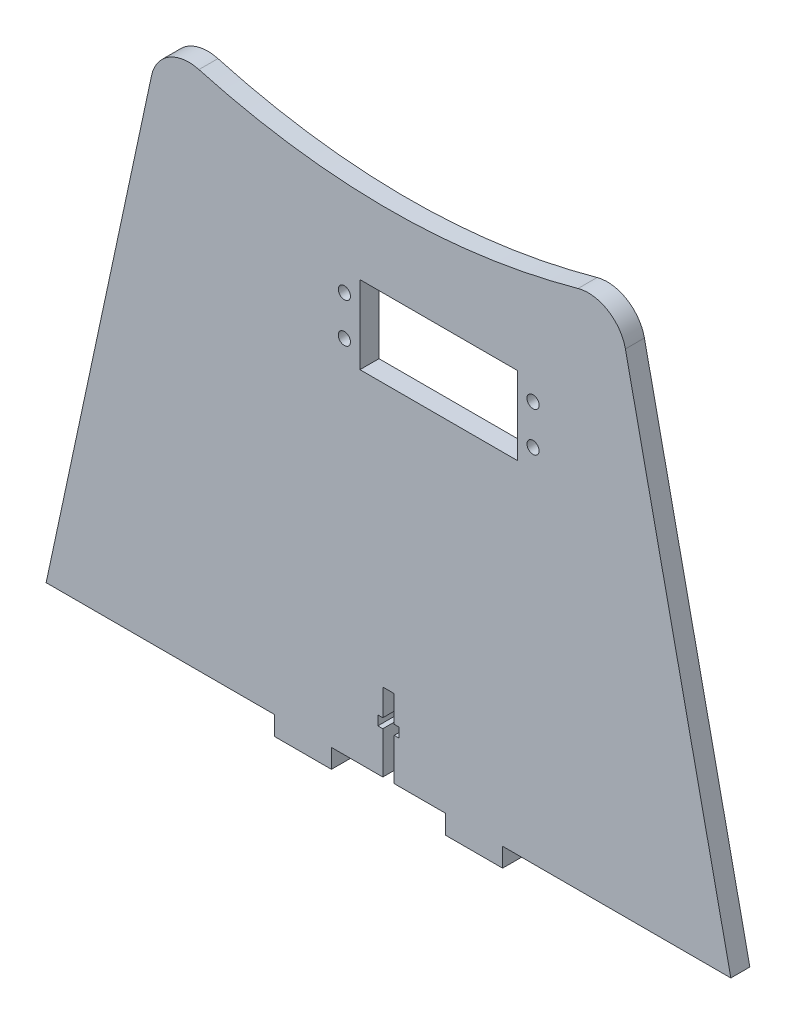
from build123d import *

# Parameters (mm, degrees)
SKETCH1_R           = 1.6
SKETCH1_W           = 41.4
SKETCH1_H           = 20.5
BOSS_EXTRUDE1_DEPTH = 5


with BuildPart() as part:
    # Sketch1 → Boss-Extrude1 (new body)
    with BuildSketch(Plane.XY):
        with BuildLine():
            Line((-27.829133209, -27.087428792), (-27.829133209, -32.087428792))
            Line((-27.829133209, -32.087428792), (-12.829133209, -32.087428792))
            Line((-12.829133209, -32.087428792), (-12.829133209, -27.087428792))
            Line((-12.829133209, -27.087428792), (0.670866791, -27.087428792))
            Line((0.670866791, -27.087428792), (0.670866791, -16.087428792))
            Line((0.670866791, -16.087428792), (-0.629133209, -16.087428792))
            Line((-0.629133209, -16.087428792), (-0.629133209, -13.587428792))
            Line((-0.629133209, -13.587428792), (0.670866791, -13.587428792))
            Line((0.670866791, -13.587428792), (0.670866791, -6.587428792))
            Line((0.670866791, -6.587428792), (3.670866791, -6.587428792))
            Line((3.670866791, -6.587428792), (3.670866791, -13.587428792))
            Line((3.670866791, -13.587428792), (4.970866791, -13.587428792))
            Line((4.970866791, -13.587428792), (4.970866791, -16.087428792))
            Line((4.970866791, -16.087428792), (3.670866791, -16.087428792))
            Line((3.670866791, -16.087428792), (3.670866791, -27.087428792))
            Line((3.670866791, -27.087428792), (17.170866791, -27.087428792))
            Line((17.170866791, -27.087428792), (17.170866791, -32.087428792))
            Line((17.170866791, -32.087428792), (32.170866791, -32.087428792))
            Line((32.170866791, -32.087428792), (32.170866791, -27.087428792))
            Line((32.170866791, -27.087428792), (92.170866791, -27.087428792))
            Line((92.170866791, -27.087428792), (64.451640551, 102.268960326))
            ThreePointArc((64.451640551, 102.268960326), (59.856128602, 108.725953776), (52.005403293, 109.81112962))
            add(Edge.make_bspline(
                [(52.005403293, 109.81112962), (35.393891125, 105.212090679), (2.170866791, 100.613051738), (-31.052157544, 105.212090679), (-47.663669711, 109.81112962)],
                knots=[0.084712196, 0.084712196, 0.084712196, 0.084712196, 0.5, 0.915287804, 0.915287804, 0.915287804, 0.915287804], degree=3))
            ThreePointArc((-47.663669711, 109.81112962), (-55.51439502, 108.725953776), (-60.10990697, 102.268960326))
            Line((-60.10990697, 102.268960326), (-87.829133209, -27.087428792))
            Line((-87.829133209, -27.087428792), (-27.829133209, -27.087428792))
        make_face()
        with Locations((-9.429133209, 78.112442288)):
            Circle(SKETCH1_R, mode=Mode.SUBTRACT)
        with Locations((-9.429133209, 67.712442288)):
            Circle(SKETCH1_R, mode=Mode.SUBTRACT)
        with Locations((40.170866791, 67.712442288)):
            Circle(SKETCH1_R, mode=Mode.SUBTRACT)
        with Locations((40.170866791, 78.112442288)):
            Circle(SKETCH1_R, mode=Mode.SUBTRACT)
        with Locations((15.370866791, 72.912571208)):
            Rectangle(SKETCH1_W, SKETCH1_H, mode=Mode.SUBTRACT)
    extrude(amount=BOSS_EXTRUDE1_DEPTH)


solid = part.part
